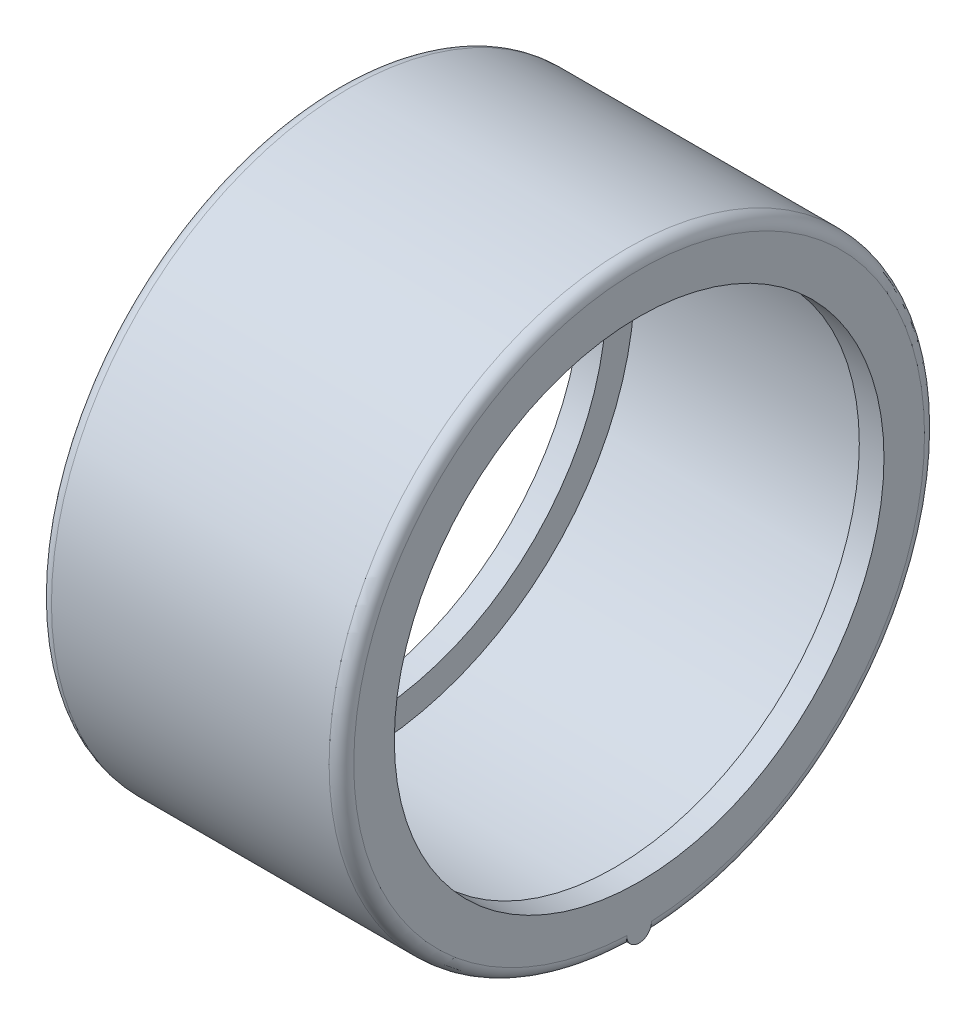
from build123d import *

# Parameters (mm, degrees)
RACCORDO1_R                  = 10
SCHIZZO2_R                   = 10
ESTRUSIONE_ESTRUSIONE1_DEPTH = 245


with BuildPart() as part:
    # Schizzo1 → Rivoluzione1 (revolve)
    with BuildSketch(Plane.XY):
        Polygon((0, 0), (0, 42.875), (-245, 42.875), (-245, 0), (-225, 0), (-225, 22.875), (-20, 22.875), (-20, 0), align=None)
    revolve(axis=Axis((-137.660777117, -198.425, 0), (-1, 0, 0)))

    # Raccordo1
    raccordo1_edges = [part.edges().sort_by_distance(p)[0] for p in [
        (-245, -439.725, 0),
        (0, -439.725, 0),
    ]]
    fillet(raccordo1_edges, radius=RACCORDO1_R)

    # Schizzo2 → Estrusione-Estrusione1 (add)
    with BuildSketch(Plane(origin=(0, 0, 0), x_dir=(0, 0, -1), z_dir=(1, 0, 0))):
        with Locations((0, -429.725)):
            Circle(SCHIZZO2_R)
    extrude(amount=-ESTRUSIONE_ESTRUSIONE1_DEPTH)


solid = part.part
